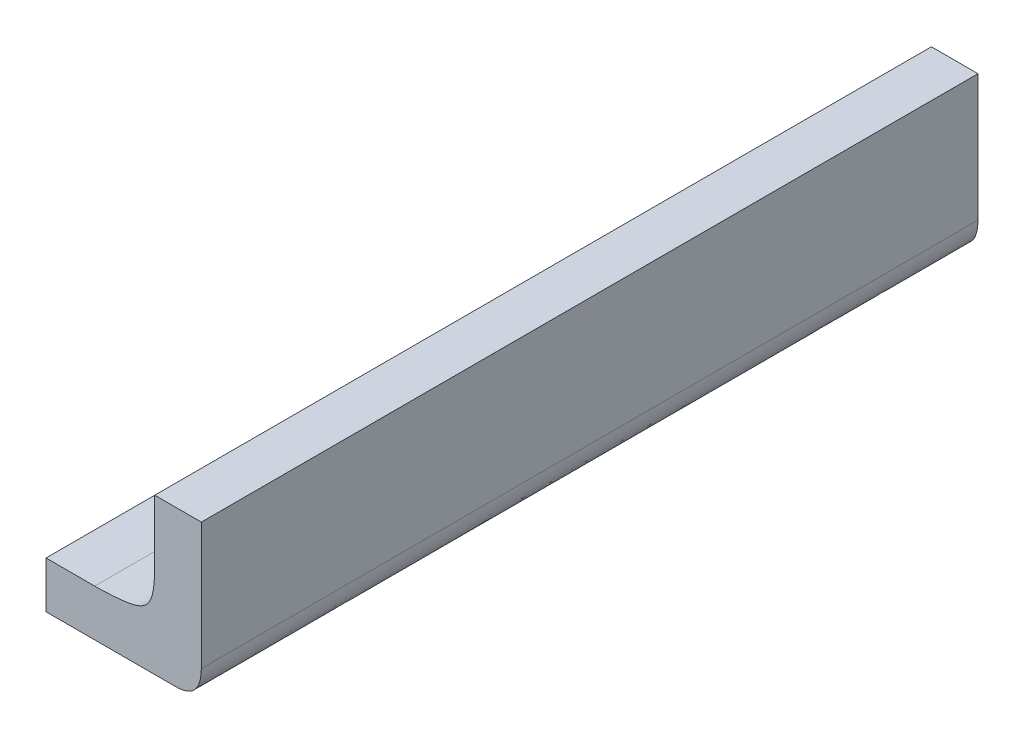
from build123d import *

# Parameters (mm, degrees)
BOSS_EXTRUDE1_DEPTH = 50


with BuildPart() as part:
    # Sketch1 → Boss-Extrude1 (new body)
    with BuildSketch(Plane.XY):
        with BuildLine():
            Line((8, -26.551688605), (8, -18.428571429))
            Line((8, -18.428571429), (5, -18.428571429))
            Line((5, -18.428571429), (5, -21.928571429))
            add(Edge.make_bspline(
                [(5, -21.928571429), (5.024758601, -24.831978652), (4.649789686, -25.256197355), (1.780732191, -25.422029081), (1.5, -25.428571429)],
                knots=[0, 0, 0, 0, 0.274480378, 0.304978198, 0.304978198, 0.304978198, 0.304978198], degree=3))
            add(Edge.make_bspline(
                [(1.5, -25.428571429), (1.487835227, -25.428854924), (1.366303422, -25.431501338), (1.24618398, -25.432201725), (1.135408239, -25.428571429)],
                knots=[0.304978198, 0.304978198, 0.304978198, 0.304978198, 0.306299739, 0.318193606, 0.318193606, 0.318193606, 0.318193606], degree=3))
            Line((1.135408239, -25.428571429), (-2, -25.428571429))
            Line((-2, -25.428571429), (-2, -28.428571429))
            Line((-2, -28.428571429), (6.375219325, -28.428571429))
            add(Edge.make_bspline(
                [(8.000000018, -26.592463548), (7.991060741, -28.414640159), (6.375219325, -28.428571429)],
                knots=[0.011004644, 0.011004644, 0.011004644, 1, 1, 1], degree=2))
            Line((8, -26.592463548), (8, -26.551688605))
        make_face()
    extrude(amount=BOSS_EXTRUDE1_DEPTH)


solid = part.part
